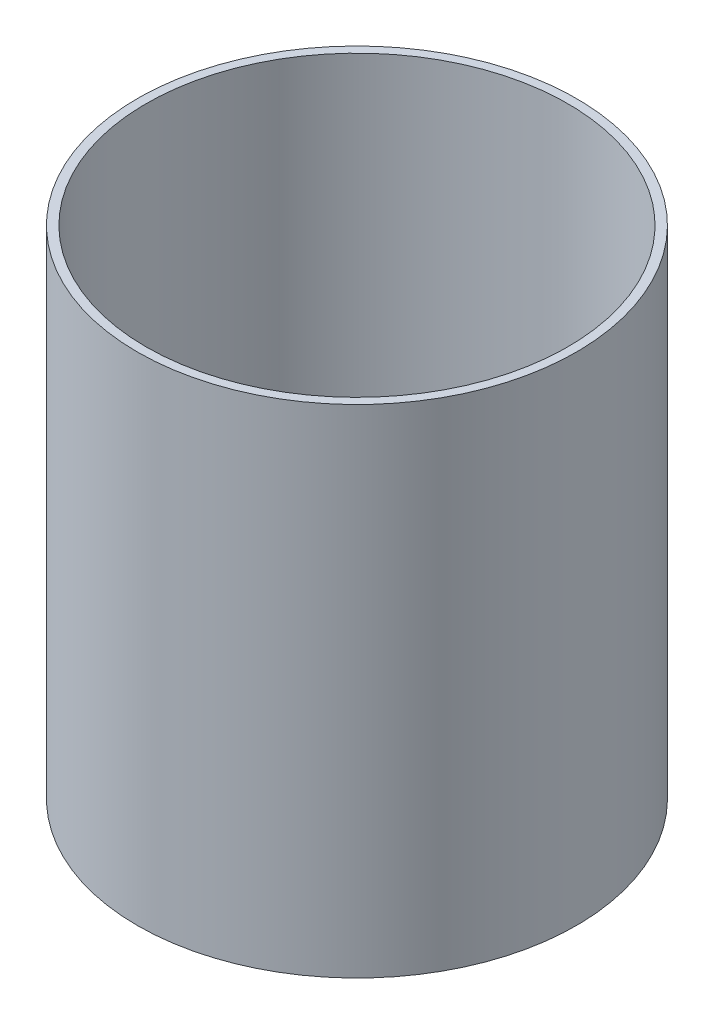
from build123d import *

# Parameters (mm, degrees)
SKETCH1_R           = 25.417
SKETCH1_R_2         = 24.401
BOSS_EXTRUDE1_DEPTH = 57.5


with BuildPart() as part:
    # Sketch1 → Boss-Extrude1 (new body)
    with BuildSketch(Plane(origin=(0, 0, 0), x_dir=(-0.9995891430214499, 0, 0.02866260898180001), z_dir=(0, 1, 0))):
        with Locations(Location((-14.14069934, -23.894783815, 0), (0, 0, 88.357528529))):
            Circle(SKETCH1_R)
        with Locations(Location((-14.14069934, -23.894783815, 0), (0, 0, 88.357528529))):
            Circle(SKETCH1_R_2, mode=Mode.SUBTRACT)
    extrude(amount=BOSS_EXTRUDE1_DEPTH)


solid = part.part
